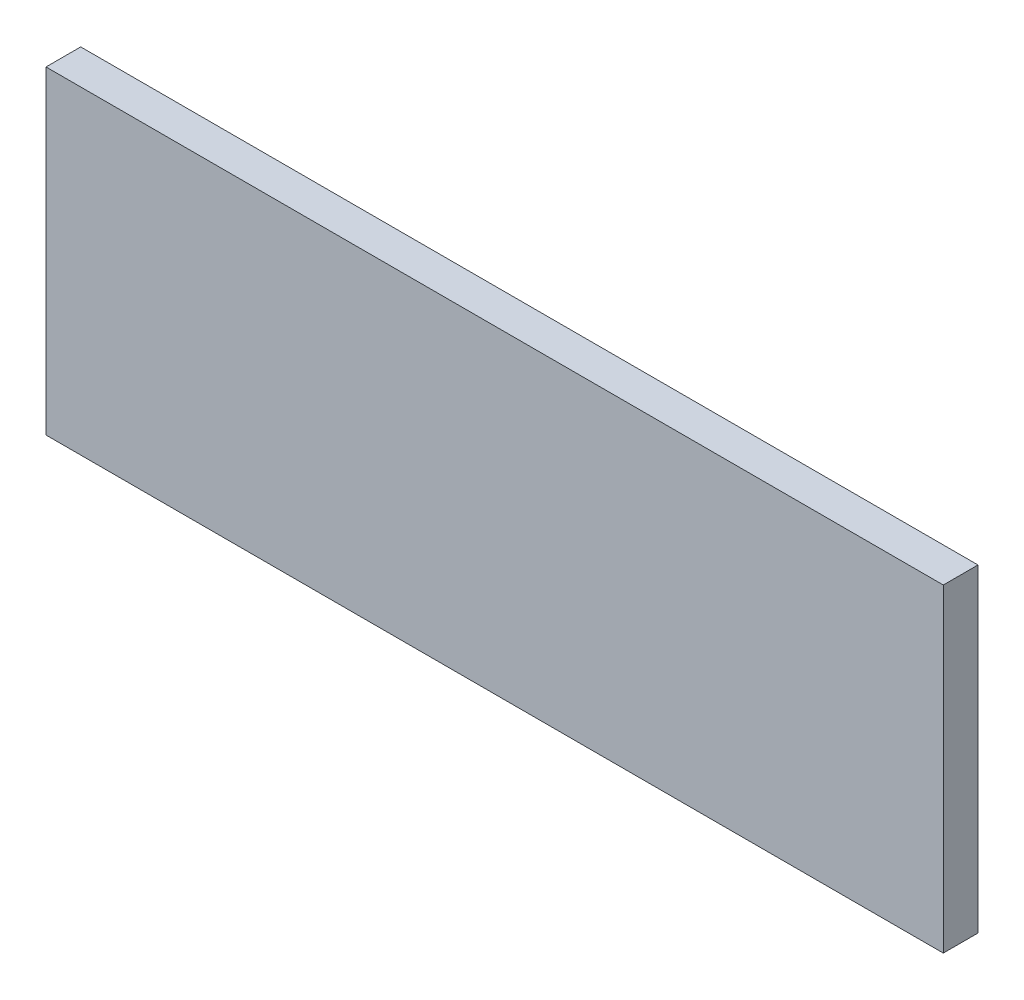
from build123d import *

# Parameters (mm, degrees)
SKETCH_1_W      = 3000
SKETCH_1_H      = 1000
EXTRUDE_2_DEPTH = 100
SKETCH_3_W      = 3102.196453332
SKETCH_3_H      = 1102.16581061
SKETCH_3_W_2    = 3000
SKETCH_3_H_2    = 1000
EXTRUDE_3_DEPTH = 120


with BuildPart() as part:
    # 草图1 → 凸台-拉伸2 (new body)
    with BuildSketch(Plane.XY):
        with Locations((1500, 500)):
            Rectangle(SKETCH_1_W, SKETCH_1_H)
    extrude(amount=EXTRUDE_2_DEPTH)

    # 草图3 → 凸台-拉伸3 (add)
    with BuildSketch(Plane.XY.offset(100)):
        with Locations((1499.472456501, 501.327082248)):
            Rectangle(SKETCH_3_W, SKETCH_3_H)
        with Locations((1500, 500)):
            Rectangle(SKETCH_3_W_2, SKETCH_3_H_2, mode=Mode.SUBTRACT)
    extrude(amount=-EXTRUDE_3_DEPTH)


solid = part.part
